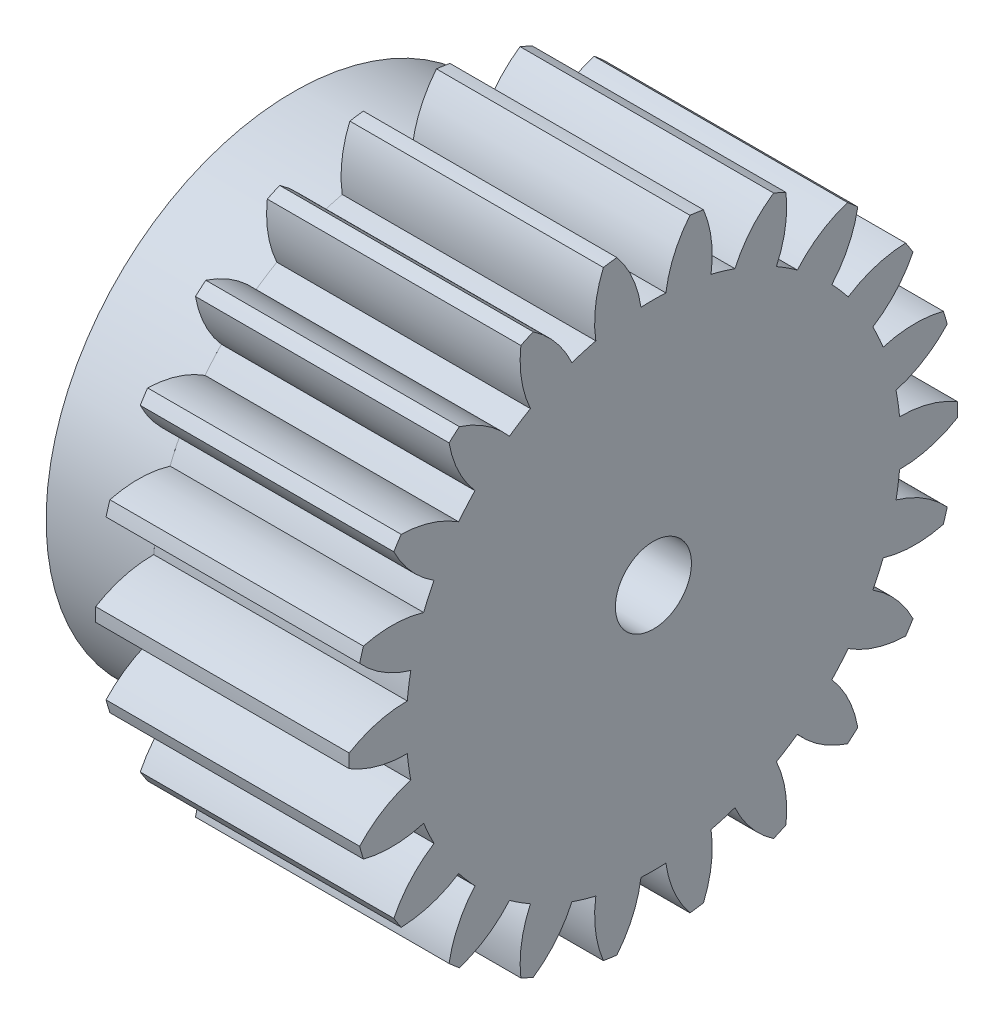
from build123d import *

# Parameters (mm, degrees)
SKETCH8_R           = 1.5
BOSS_EXTRUDE1_DEPTH = 10
SKETCH13_W          = 4.2
SKETCH13_H          = 9.75
CUT_EXTRUDE2_DEPTH  = 3.2
SKETCH20_W          = 1.5
SKETCH20_H          = 4.2


with BuildPart() as part:
    # Sketch8 → Boss-Extrude1 (new body)
    with BuildSketch(Plane(origin=(4.038890567, 0, 0), x_dir=(0, 0, -1), z_dir=(1, 0, 0))):
        with BuildLine():
            ThreePointArc((-8.767047038, 4.183890551), (-7.665653193, 3.710793481), (-6.477446097, 3.552511658))
            ThreePointArc((-6.477446097, 3.552511658), (-6.419815651, 3.06474668), (-6.337692385, 2.580503238))
            ThreePointArc((-6.337692385, 2.580503238), (-7.433175602, 2.093876318), (-8.35666841, 1.329644499))
            ThreePointArc((-8.35666841, 1.329644499), (-8.283962098, 1.071383356), (-8.205500024, 0.814812257))
            ThreePointArc((-8.205500024, 0.814812257), (-7.015433522, 0.671177447), (-5.830764019, 0.854063773))
            ThreePointArc((-5.830764019, 0.854063773), (-5.638048737, 0.402293077), (-5.422824897, -0.039198306))
            ThreePointArc((-5.422824897, -0.039198306), (-6.3368347, -0.814746704), (-7.007610576, -1.808199754))
            ThreePointArc((-7.007610576, -1.808199754), (-6.865088808, -2.035515771), (-6.717520569, -2.259588617))
            ThreePointArc((-6.717520569, -2.259588617), (-5.535193519, -2.06212473), (-4.450036487, -1.552886617))
            ThreePointArc((-4.450036487, -1.552886617), (-4.137849015, -1.932063257), (-3.806960756, -2.295035573))
            ThreePointArc((-3.806960756, -2.295035573), (-4.465449507, -3.296675131), (-4.829166179, -4.438865755))
            ThreePointArc((-4.829166179, -4.438865755), (-4.628375221, -4.616820854), (-4.423655917, -4.790242398))
            ThreePointArc((-4.423655917, -4.790242398), (-3.344853426, -4.267677163), (-2.447121834, -3.473342707))
            ThreePointArc((-2.447121834, -3.473342707), (-2.040753744, -3.749206653), (-1.621007666, -4.004254045))
            ThreePointArc((-1.621007666, -4.004254045), (-1.970628521, -5.150837883), (-1.997819828, -6.349232589))
            ThreePointArc((-1.997819828, -6.349232589), (-1.75502657, -6.463409906), (-1.50974134, -6.572130566))
            ThreePointArc((-1.50974134, -6.572130566), (-0.62186157, -5.76679911), (0.015715707, -4.751720564))
            ThreePointArc((0.015715707, -4.751720564), (0.483342889, -4.901922961), (0.957941455, -5.028383006))
            ThreePointArc((0.957941455, -5.028383006), (0.945512697, -6.22702172), (1.257049634, -7.384533696))
            ThreePointArc((1.257049634, -7.384533696), (1.522175527, -7.425683264), (1.788155131, -7.460895139))
            ThreePointArc((1.788155131, -7.460895139), (2.413181441, -6.438040628), (2.738951684, -5.284453619))
            ThreePointArc((2.738951684, -5.284453619), (3.229953586, -5.296825962), (3.720955487, -5.284453619))
            ThreePointArc((3.720955487, -5.284453619), (4.04672573, -6.438040628), (4.671752041, -7.460895139))
            ThreePointArc((4.671752041, -7.460895139), (4.937731645, -7.425683264), (5.202857538, -7.384533696))
            ThreePointArc((5.202857538, -7.384533696), (5.514394474, -6.22702172), (5.501965716, -5.028383006))
            ThreePointArc((5.501965716, -5.028383006), (5.976564282, -4.901922961), (6.444191465, -4.751720564))
            ThreePointArc((6.444191465, -4.751720564), (7.081768742, -5.76679911), (7.969648512, -6.572130566))
            ThreePointArc((7.969648512, -6.572130566), (8.214933742, -6.463409906), (8.457727, -6.349232589))
            ThreePointArc((8.457727, -6.349232589), (8.430535693, -5.150837883), (8.080914837, -4.004254045))
            ThreePointArc((8.080914837, -4.004254045), (8.500660915, -3.749206653), (8.907029006, -3.473342707))
            ThreePointArc((8.907029006, -3.473342707), (9.804760597, -4.267677163), (10.883563088, -4.790242398))
            ThreePointArc((10.883563088, -4.790242398), (11.088282393, -4.616820854), (11.289073351, -4.438865755))
            ThreePointArc((11.289073351, -4.438865755), (10.925356678, -3.296675131), (10.266867928, -2.295035573))
            ThreePointArc((10.266867928, -2.295035573), (10.597756186, -1.932063257), (10.909943659, -1.552886617))
            ThreePointArc((10.909943659, -1.552886617), (11.995100691, -2.06212473), (13.17742774, -2.259588617))
            ThreePointArc((13.17742774, -2.259588617), (13.32499598, -2.035515771), (13.467517748, -1.808199754))
            ThreePointArc((13.467517748, -1.808199754), (12.796741871, -0.814746704), (11.882732068, -0.039198306))
            ThreePointArc((11.882732068, -0.039198306), (12.097955909, 0.402293077), (12.290671191, 0.854063773))
            ThreePointArc((12.290671191, 0.854063773), (13.475340694, 0.671177447), (14.665407196, 0.814812257))
            ThreePointArc((14.665407196, 0.814812257), (14.743869269, 1.071383356), (14.816575582, 1.329644499))
            ThreePointArc((14.816575582, 1.329644499), (13.893082774, 2.093876318), (12.797599556, 2.580503238))
            ThreePointArc((12.797599556, 2.580503238), (12.879722823, 3.06474668), (12.937353269, 3.552511658))
            ThreePointArc((12.937353269, 3.552511658), (14.125560365, 3.710793481), (15.22695421, 4.183890551))
            ThreePointArc((15.22695421, 4.183890551), (15.229953586, 4.452174038), (15.22695421, 4.720457526))
            ThreePointArc((15.22695421, 4.720457526), (14.125560365, 5.193554596), (12.937353269, 5.351836419))
            ThreePointArc((12.937353269, 5.351836419), (12.879722823, 5.839601397), (12.797599556, 6.323844839))
            ThreePointArc((12.797599556, 6.323844839), (13.893082774, 6.810471759), (14.816575582, 7.574703578))
            ThreePointArc((14.816575582, 7.574703578), (14.743869269, 7.832964721), (14.665407196, 8.08953582))
            ThreePointArc((14.665407196, 8.08953582), (13.475340694, 8.23317063), (12.290671191, 8.050284304))
            ThreePointArc((12.290671191, 8.050284304), (12.097955909, 8.502055), (11.882732068, 8.943546382))
            ThreePointArc((11.882732068, 8.943546382), (12.796741871, 9.719094781), (13.467517748, 10.712547831))
            ThreePointArc((13.467517748, 10.712547831), (13.32499598, 10.939863848), (13.17742774, 11.163936694))
            ThreePointArc((13.17742774, 11.163936694), (11.995100691, 10.966472807), (10.909943659, 10.457234694))
            ThreePointArc((10.909943659, 10.457234694), (10.597756186, 10.836411334), (10.266867928, 11.19938365))
            ThreePointArc((10.266867928, 11.19938365), (10.925356678, 12.201023208), (11.289073351, 13.343213832))
            ThreePointArc((11.289073351, 13.343213832), (11.088282393, 13.521168931), (10.883563088, 13.694590475))
            ThreePointArc((10.883563088, 13.694590475), (9.804760597, 13.17202524), (8.907029006, 12.377690783))
            ThreePointArc((8.907029006, 12.377690783), (8.500660915, 12.65355473), (8.080914837, 12.908602122))
            ThreePointArc((8.080914837, 12.908602122), (8.430535693, 14.05518596), (8.457727, 15.253580666))
            ThreePointArc((8.457727, 15.253580666), (8.214933742, 15.367757983), (7.969648512, 15.476478643))
            ThreePointArc((7.969648512, 15.476478643), (7.081768742, 14.671147187), (6.444191465, 13.656068641))
            ThreePointArc((6.444191465, 13.656068641), (5.976564282, 13.806271038), (5.501965716, 13.932731083))
            ThreePointArc((5.501965716, 13.932731083), (5.514394474, 15.131369796), (5.202857538, 16.288881773))
            ThreePointArc((5.202857538, 16.288881773), (4.937731645, 16.330031341), (4.671752041, 16.365243215))
            ThreePointArc((4.671752041, 16.365243215), (4.04672573, 15.342388705), (3.720955487, 14.188801696))
            ThreePointArc((3.720955487, 14.188801696), (3.229953586, 14.201174038), (2.738951684, 14.188801696))
            ThreePointArc((2.738951684, 14.188801696), (2.413181441, 15.342388705), (1.788155131, 16.365243215))
            ThreePointArc((1.788155131, 16.365243215), (1.522175527, 16.330031341), (1.257049634, 16.288881773))
            ThreePointArc((1.257049634, 16.288881773), (0.945512697, 15.131369796), (0.957941455, 13.932731083))
            ThreePointArc((0.957941455, 13.932731083), (0.483342889, 13.806271038), (0.015715707, 13.656068641))
            ThreePointArc((0.015715707, 13.656068641), (-0.62186157, 14.671147187), (-1.50974134, 15.476478643))
            ThreePointArc((-1.50974134, 15.476478643), (-1.75502657, 15.367757983), (-1.997819828, 15.253580666))
            ThreePointArc((-1.997819828, 15.253580666), (-1.970628521, 14.05518596), (-1.621007666, 12.908602122))
            ThreePointArc((-1.621007666, 12.908602122), (-2.040753744, 12.65355473), (-2.447121834, 12.377690783))
            ThreePointArc((-2.447121834, 12.377690783), (-3.344853426, 13.17202524), (-4.423655917, 13.694590475))
            ThreePointArc((-4.423655917, 13.694590475), (-4.628375221, 13.521168931), (-4.829166179, 13.343213832))
            ThreePointArc((-4.829166179, 13.343213832), (-4.465449507, 12.201023208), (-3.806960756, 11.19938365))
            ThreePointArc((-3.806960756, 11.19938365), (-4.137849015, 10.836411334), (-4.450036487, 10.457234694))
            ThreePointArc((-4.450036487, 10.457234694), (-5.535193519, 10.966472807), (-6.717520569, 11.163936694))
            ThreePointArc((-6.717520569, 11.163936694), (-6.865088808, 10.939863848), (-7.007610576, 10.712547831))
            ThreePointArc((-7.007610576, 10.712547831), (-6.3368347, 9.719094781), (-5.422824897, 8.943546382))
            ThreePointArc((-5.422824897, 8.943546382), (-5.638048737, 8.502055), (-5.830764019, 8.050284304))
            ThreePointArc((-5.830764019, 8.050284304), (-7.015433522, 8.23317063), (-8.205500024, 8.08953582))
            ThreePointArc((-8.205500024, 8.08953582), (-8.283962098, 7.832964721), (-8.35666841, 7.574703578))
            ThreePointArc((-8.35666841, 7.574703578), (-7.433175602, 6.810471759), (-6.337692385, 6.323844839))
            ThreePointArc((-6.337692385, 6.323844839), (-6.419815651, 5.839601397), (-6.477446097, 5.351836419))
            ThreePointArc((-6.477446097, 5.351836419), (-7.665653193, 5.193554596), (-8.767047038, 4.720457526))
            ThreePointArc((-8.767047038, 4.720457526), (-8.770046414, 4.452174038), (-8.767047038, 4.183890551))
        make_face()
        with Locations((3.229953586, 4.452174038)):
            Circle(SKETCH8_R, mode=Mode.SUBTRACT)
    extrude(amount=-BOSS_EXTRUDE1_DEPTH)


with BuildPart() as body_2:
    # Sketch13 → Revolve2 (revolve)
    with BuildSketch(Plane.XY.offset(-3.229953586), mode=Mode.PRIVATE) as revolve2_sk:
        with Locations((-8.061109433, 9.327174038)):
            Rectangle(SKETCH13_W, SKETCH13_H)
    revolve(revolve2_sk.sketch.rotate(Axis((-10.161109433, 4.452174038, -3.229953586), (1, 0, 0)), 270), axis=Axis((-10.161109433, 4.452174038, -3.229953586), (1, 0, 0)))

    # Sketch19 → Cut-Extrude2 (cut)
    with BuildSketch(Plane.ZY.offset(10.161109433)):
        with BuildLine():
            Line((-6.063631676, 5.068833168), (-5.908663279, 4.790573769))
            Line((-5.908663279, 4.790573769), (-6.127963357, 4.559595474))
            ThreePointArc((-6.127963357, 4.559595474), (-6.129953586, 4.452174038), (-6.127963357, 4.344752603))
            Line((-6.127963357, 4.344752603), (-5.908663279, 4.113774308))
            Line((-5.908663279, 4.113774308), (-6.063631676, 3.835514909))
            ThreePointArc((-6.063631676, 3.835514909), (-6.038844753, 3.730973366), (-6.010202427, 3.627421722))
            Line((-6.010202427, 3.627421722), (-5.740350098, 3.458237746))
            Line((-5.740350098, 3.458237746), (-5.821249579, 3.150181305))
            ThreePointArc((-5.821249579, 3.150181305), (-5.771242958, 3.055088384), (-5.717748236, 2.961913062))
            Line((-5.717748236, 2.961913062), (-5.414299471, 2.865153857))
            Line((-5.414299471, 2.865153857), (-5.416046824, 2.546656693))
            ThreePointArc((-5.416046824, 2.546656693), (-5.343962605, 2.466987431), (-5.268976758, 2.39004298))
            Line((-5.268976758, 2.39004298), (-4.950998358, 2.371788283))
            Line((-4.950998358, 2.371788283), (-4.873483791, 2.062862743))
            ThreePointArc((-4.873483791, 2.062862743), (-4.783851291, 2.003623054), (-4.692085956, 1.947744177))
            Line((-4.692085956, 1.947744177), (-4.379557673, 2.009140997))
            Line((-4.379557673, 2.009140997), (-4.227651711, 1.72919801))
            ThreePointArc((-4.227651711, 1.72919801), (-4.12610287, 1.694110141), (-4.023323999, 1.662807912))
            Line((-4.023323999, 1.662807912), (-3.735883135, 1.799998461))
            Line((-3.735883135, 1.799998461), (-3.519130589, 1.566627875))
            ThreePointArc((-3.519130589, 1.566627875), (-3.412046092, 1.557896526), (-3.304711661, 1.55313778))
            Line((-3.304711661, 1.55313778), (-3.060419183, 1.757501872))
            Line((-3.060419183, 1.757501872), (-2.792439412, 1.585367218))
            ThreePointArc((-2.792439412, 1.585367218), (-2.686547774, 1.603541011), (-2.581401999, 1.625624757))
            Line((-2.581401999, 1.625624757), (-2.395607701, 1.884321444))
            Line((-2.395607701, 1.884321444), (-2.093238859, 1.784238576))
            ThreePointArc((-2.093238859, 1.784238576), (-1.99519364, 1.828175586), (-1.898843218, 1.875714222))
            Line((-1.898843218, 1.875714222), (-1.783221239, 2.17248864))
            Line((-1.783221239, 2.17248864), (-1.465462274, 2.150746132))
            ThreePointArc((-1.465462274, 2.150746132), (-1.381424016, 2.217685634), (-1.299922997, 2.287692132))
            Line((-1.299922997, 2.287692132), (-1.261738292, 2.603896852))
            Line((-1.261738292, 2.603896852), (-0.948555166, 2.661860867))
            ThreePointArc((-0.948555166, 2.661860867), (-0.883804302, 2.747596807), (-0.822273695, 2.835672401))
            Line((-0.822273695, 2.835672401), (-0.86392555, 3.151439118))
            Line((-0.86392555, 3.151439118), (-0.574996712, 3.285467563))
            ThreePointArc((-0.574996712, 3.285467563), (-0.533601777, 3.384612836), (-0.495907777, 3.485223412))
            Line((-0.495907777, 3.485223412), (-0.614779051, 3.780711343))
            Line((-0.614779051, 3.780711343), (-0.368258963, 3.982382718))
            ThreePointArc((-0.368258963, 3.982382718), (-0.352820952, 4.088707661), (-0.341332011, 4.195531488))
            Line((-0.341332011, 4.195531488), (-0.529953586, 4.452174038))
            Line((-0.529953586, 4.452174038), (-0.341332011, 4.708816589))
            ThreePointArc((-0.341332011, 4.708816589), (-0.352820952, 4.815640416), (-0.368258963, 4.921965359))
            Line((-0.368258963, 4.921965359), (-0.614779051, 5.123636734))
            Line((-0.614779051, 5.123636734), (-0.495907777, 5.419124665))
            ThreePointArc((-0.495907777, 5.419124665), (-0.533601777, 5.519735241), (-0.574996712, 5.618880514))
            Line((-0.574996712, 5.618880514), (-0.86392555, 5.752908958))
            Line((-0.86392555, 5.752908958), (-0.822273695, 6.068675676))
            ThreePointArc((-0.822273695, 6.068675676), (-0.883804302, 6.15675127), (-0.948555166, 6.24248721))
            Line((-0.948555166, 6.24248721), (-1.261738292, 6.300451224))
            Line((-1.261738292, 6.300451224), (-1.299922997, 6.616655945))
            ThreePointArc((-1.299922997, 6.616655945), (-1.381424016, 6.686662442), (-1.465462274, 6.753601945))
            Line((-1.465462274, 6.753601945), (-1.783221239, 6.731859437))
            Line((-1.783221239, 6.731859437), (-1.898843218, 7.028633855))
            ThreePointArc((-1.898843218, 7.028633855), (-1.99519364, 7.076172491), (-2.093238859, 7.120109501))
            Line((-2.093238859, 7.120109501), (-2.395607701, 7.020026632))
            Line((-2.395607701, 7.020026632), (-2.581401999, 7.27872332))
            ThreePointArc((-2.581401999, 7.27872332), (-2.686547774, 7.300807066), (-2.792439412, 7.318980859))
            Line((-2.792439412, 7.318980859), (-3.060419183, 7.146846205))
            Line((-3.060419183, 7.146846205), (-3.304711661, 7.351210297))
            ThreePointArc((-3.304711661, 7.351210297), (-3.412046092, 7.346451551), (-3.519130589, 7.337720202))
            Line((-3.519130589, 7.337720202), (-3.735883135, 7.104349615))
            Line((-3.735883135, 7.104349615), (-4.023323999, 7.241540165))
            ThreePointArc((-4.023323999, 7.241540165), (-4.12610287, 7.210237936), (-4.227651711, 7.175150067))
            Line((-4.227651711, 7.175150067), (-4.379557673, 6.89520708))
            Line((-4.379557673, 6.89520708), (-4.692085956, 6.9566039))
            ThreePointArc((-4.692085956, 6.9566039), (-4.783851291, 6.900725022), (-4.873483791, 6.841485333))
            Line((-4.873483791, 6.841485333), (-4.950998358, 6.532559794))
            Line((-4.950998358, 6.532559794), (-5.268976758, 6.514305097))
            ThreePointArc((-5.268976758, 6.514305097), (-5.343962605, 6.437360646), (-5.416046824, 6.357691384))
            Line((-5.416046824, 6.357691384), (-5.414299471, 6.03919422))
            Line((-5.414299471, 6.03919422), (-5.717748236, 5.942435015))
            ThreePointArc((-5.717748236, 5.942435015), (-5.771242958, 5.849259693), (-5.821249579, 5.754166772))
            Line((-5.821249579, 5.754166772), (-5.740350098, 5.446110331))
            Line((-5.740350098, 5.446110331), (-6.010202427, 5.276926355))
            ThreePointArc((-6.010202427, 5.276926355), (-6.038844753, 5.173374711), (-6.063631676, 5.068833168))
        make_face()
    extrude(amount=-CUT_EXTRUDE2_DEPTH, mode=Mode.SUBTRACT)

    # Sketch20 → Ø3.0 (3) Diameter Hole2 (revolve, cut)
    with BuildSketch(Plane(origin=(-5.961109433, 4.452174038, -3.229953586), x_dir=(0, 0, -1), z_dir=(0, 1, 0))):
        with Locations((0.75, 2.1)):
            Rectangle(SKETCH20_W, SKETCH20_H)
    revolve(axis=Axis((0.388890567, 4.452174038, -3.229953586), (-1, 0, 0)), mode=Mode.SUBTRACT)


solid = Compound([part.part, body_2.part])
